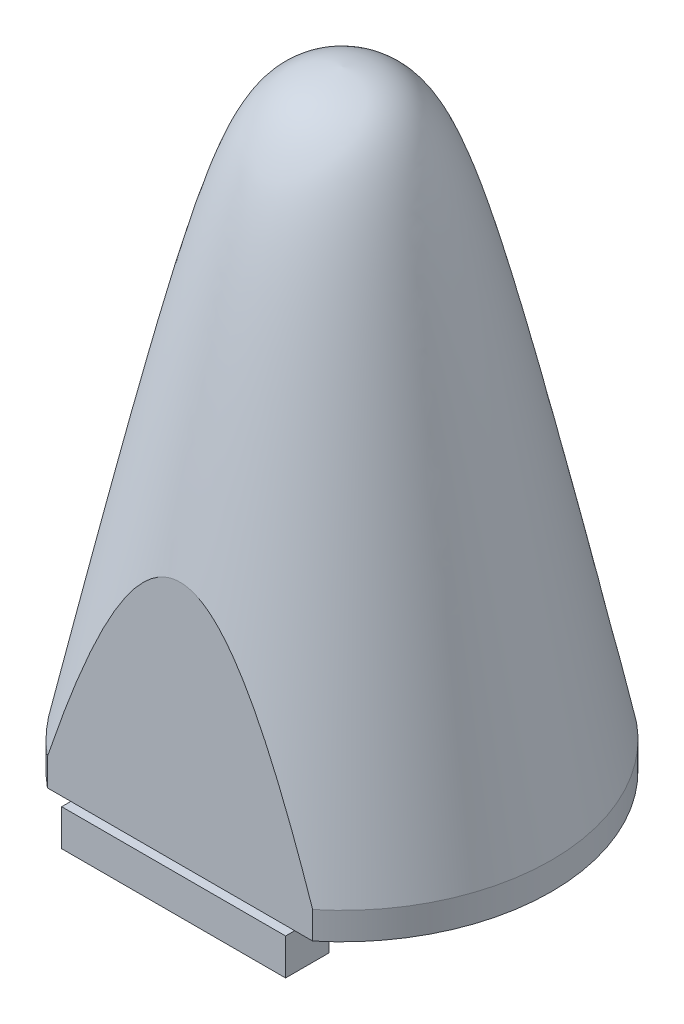
from build123d import *

# Parameters (mm, degrees)
SKETCH_4_R          = 11.5
EXTRUDE_1_DEPTH     = 1.5
EXTRUDE_2_DEPTH     = 4
SKETCH_7_W          = 13
SKETCH_7_H          = 10.04
CUT_EXTRUDE_3_DEPTH = 2
CUT_EXTRUDE_4_DEPTH = 38.239092514
SKETCH_9_W          = 12.301126192
SKETCH_9_H          = 2
EXTRUDE_3_DEPTH     = 1
SKETCH_10_W         = 12.301126192
SKETCH_10_H         = 2
EXTRUDE_4_DEPTH     = 1


with BuildPart() as part:
    # 草图2 → 旋转1 (revolve)
    with BuildSketch(Plane.XY):
        with BuildLine():
            Line((0, 0), (-11.5, 0))
            add(Edge.make_bspline(
                [(0, 32), (-4.710300768, 31.615095885), (-11.5, 0)],
                knots=[0, 0, 0, 1, 1, 1], degree=2, weights=[1, 2.551315819, 1]))
            Line((0, 32), (0, 0))
        make_face()
    revolve(axis=Axis((0, 0, 0), (0, 1, 0)))

    # 草图3 → 切除-旋转1 (revolve, cut)
    with BuildSketch(Plane.XY, mode=Mode.PRIVATE) as cut_revolve_1_sk:
        Polygon((0, 31), (0, 0), (-8, 0), align=None)
    revolve(cut_revolve_1_sk.sketch.rotate(Axis((0, 31, 0), (0, -1, 0)), 180), axis=Axis((0, 31, 0), (0, -1, 0)), mode=Mode.SUBTRACT)

    # 草图4 → 凸台-拉伸1 (add)
    with BuildSketch(Plane(origin=(0, 0, 0), x_dir=(1, 0, 0), z_dir=(0, 1, 0))):
        with Locations(Location((0, 0, 0), (0, 0, 270))):
            Circle(SKETCH_4_R)
    extrude(amount=-EXTRUDE_1_DEPTH)

    # 草图5 → 凸台-拉伸2 (add)
    with BuildSketch(Plane.XZ.offset(1.5)):
        Polygon((4.301126192, 6.4), (4.301126192, 5.02), (-6.5, 5.02), (-6.5, -5.02), (4.301126192, -5.02), (4.301126192, -6.4), (-6.618873808, -6.4), (-8, -6.4), (-8, 6.4), (-6.618873808, 6.4), align=None)
    extrude(amount=EXTRUDE_2_DEPTH)

    # 草图7 → 切除-拉伸3 (cut)
    with BuildSketch(Plane.XZ.offset(1.5)):
        Rectangle(SKETCH_7_W, SKETCH_7_H)
    extrude(amount=-CUT_EXTRUDE_3_DEPTH, mode=Mode.SUBTRACT)

    # 草图8 → 切除-拉伸4 (cut, through all)
    with BuildSketch(Plane(origin=(0, -1.5, 0), x_dir=(-1, 0, 0), z_dir=(0, -1, 0))):
        with BuildLine():
            Line((10.500185713, -4.69), (10.500185713, 4.69))
            ThreePointArc((10.500185713, 4.69), (11.5, 0), (10.500185713, -4.69))
        make_face()
        with BuildLine():
            Line((7.285, -8.898245614), (-7.285, -8.898245614))
            ThreePointArc((-7.285, -8.898245614), (0, -11.5), (7.285, -8.898245614))
        make_face()
        with BuildLine():
            Line((7.285, 8.898245614), (-7.285, 8.898245614))
            ThreePointArc((-7.285, 8.898245614), (0, 11.5), (7.285, 8.898245614))
        make_face()
    extrude(amount=-CUT_EXTRUDE_4_DEPTH, mode=Mode.SUBTRACT)

    # 草图9 → 凸台-拉伸3 (add)
    with BuildSketch(Plane.XY.offset(6.4)):
        with Locations((-1.849436904, -4.5)):
            Rectangle(SKETCH_9_W, SKETCH_9_H)
    extrude(amount=EXTRUDE_3_DEPTH)

    # 草图10 → 凸台-拉伸4 (add)
    with BuildSketch(Plane(origin=(0, 0, -6.4), x_dir=(-1, 0, 0), z_dir=(0, 0, -1))):
        with Locations((1.849436904, -4.5)):
            Rectangle(SKETCH_10_W, SKETCH_10_H)
    extrude(amount=EXTRUDE_4_DEPTH)


solid = part.part
